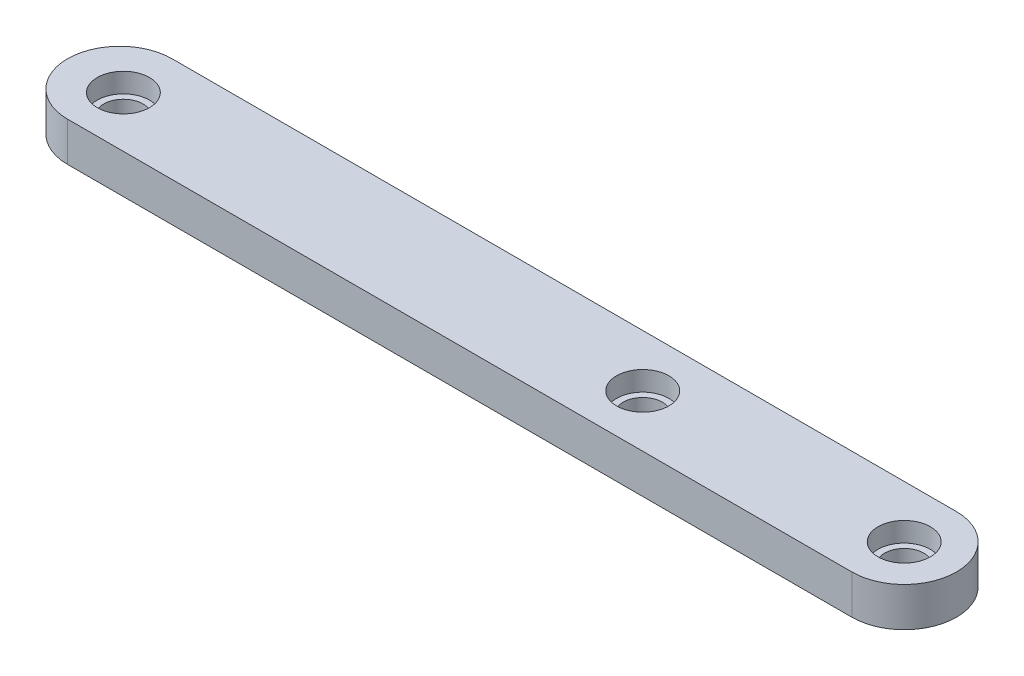
from build123d import *

# Parameters (mm, degrees)
SKETCH1_R           = 3
BOSS_EXTRUDE1_DEPTH = 6
SKETCH3_R           = 4
CUT_EXTRUDE1_DEPTH  = 3


with BuildPart() as part:
    # Sketch1 → Boss-Extrude1 (new body)
    with BuildSketch(Plane(origin=(0, 0, 0), x_dir=(1, 0, 0), z_dir=(0, 1, 0))):
        with BuildLine():
            Line((-60, -8), (60, -8))
            ThreePointArc((60, -8), (68, 0), (60, 8))
            Line((60, 8), (-60, 8))
            ThreePointArc((-60, 8), (-68, 0), (-60, -8))
        make_face()
        with Locations(Location((-59.243309237, -0.211557176, 0), (0, 0, 270))):
            Circle(SKETCH1_R, mode=Mode.SUBTRACT)
        with Locations(Location((60, 0, 0), (0, 0, 270))):
            Circle(SKETCH1_R, mode=Mode.SUBTRACT)
        with Locations(Location((20, 0, 0), (0, 0, 270))):
            Circle(SKETCH1_R, mode=Mode.SUBTRACT)
    extrude(amount=BOSS_EXTRUDE1_DEPTH)

    # Sketch3 → Cut-Extrude1 (cut)
    with BuildSketch(Plane(origin=(0, 6, 0), x_dir=(1, 0, 0), z_dir=(0, 1, 0))):
        with Locations(Location((-59.243309237, -0.211557176, 0), (0, 0, 270))):
            Circle(SKETCH3_R)
        with Locations(Location((20, 0, 0), (0, 0, 270))):
            Circle(SKETCH3_R)
        with Locations(Location((60, 0, 0), (0, 0, 270))):
            Circle(SKETCH3_R)
    extrude(amount=-CUT_EXTRUDE1_DEPTH, mode=Mode.SUBTRACT)


solid = part.part
